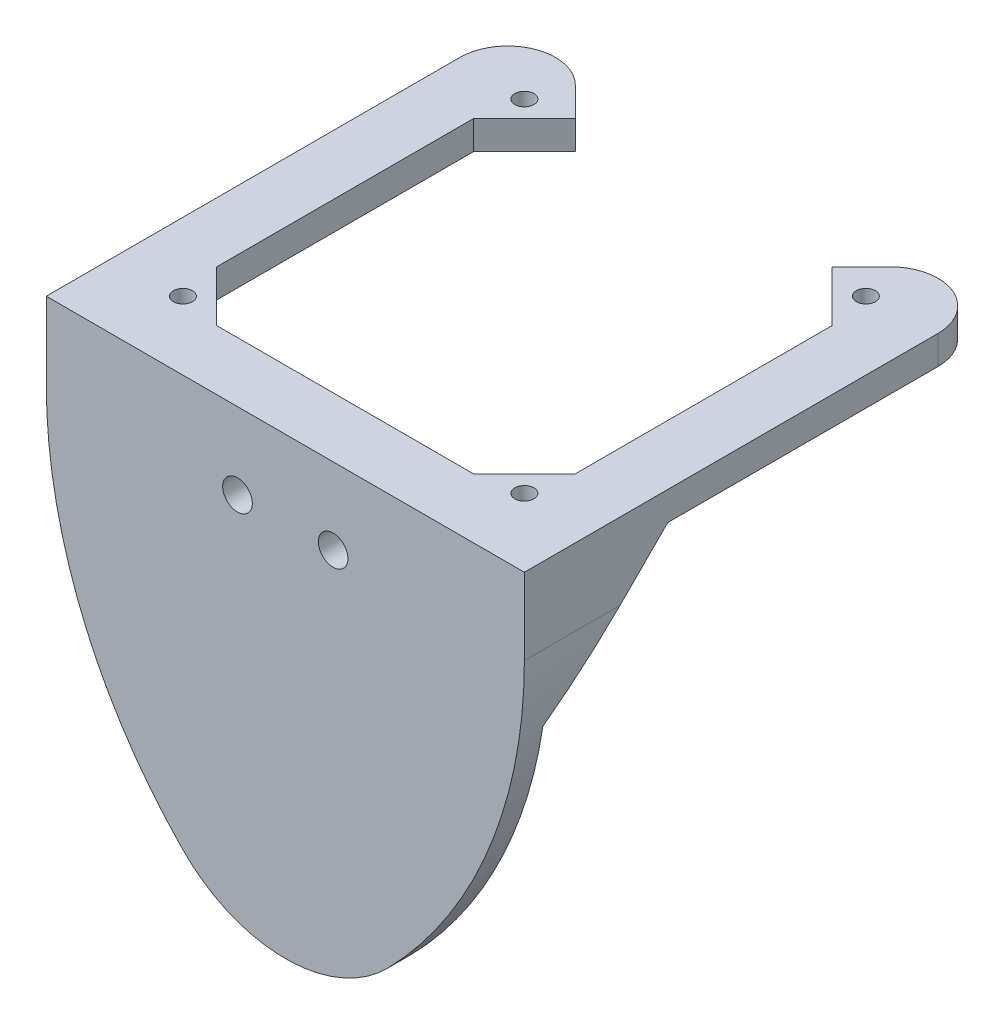
from build123d import *

# Parameters (mm, degrees)
SKETCH1_R           = 2
BOSS_EXTRUDE1_DEPTH = 6
CUT_EXTRUDE1_DEPTH  = 2.3
SKETCH3_R           = 3.1
BOSS_EXTRUDE2_DEPTH = 5
BOSS_EXTRUDE3_DEPTH = 5
FILLET1_R           = 7.5
BOSS_EXTRUDE4_DEPTH = 5
CUT_EXTRUDE2_REACH  = 139.089


with BuildPart() as part:
    # Sketch1 → Boss-Extrude1 (new body)
    with BuildSketch(Plane(origin=(0, 0, 0), x_dir=(1, 0, 0), z_dir=(0, 1, 0))):
        with BuildLine():
            Line((26.846717088, 0), (37.5, 10.653282912))
            Line((37.5, 10.653282912), (37.5, 64.346717088))
            Line((37.5, 64.346717088), (26.846717088, 75))
            Line((26.846717088, 75), (32.928932188, 81.0822151))
            ThreePointArc((32.928932188, 81.0822151), (43.826834324, 83.249942613), (50, 74.011147288))
            Line((50, 74.011147288), (50, -12.5))
            Line((50, -12.5), (-50, -12.5))
            Line((-50, -12.5), (-50, 74.011147288))
            ThreePointArc((-50, 74.011147288), (-43.826834324, 83.249942613), (-32.928932188, 81.0822151))
            Line((-32.928932188, 81.0822151), (-26.846717088, 75))
            Line((-26.846717088, 75), (-37.5, 64.346717088))
            Line((-37.5, 64.346717088), (-37.5, 10.653282912))
            Line((-37.5, 10.653282912), (-26.846717088, 0))
            Line((-26.846717088, 0), (26.846717088, 0))
        make_face()
        with Locations(Location((35.70889245, 1.79110755, 0), (0, 0, 270))):
            Circle(SKETCH1_R, mode=Mode.SUBTRACT)
        with Locations(Location((-35.70889245, 1.79110755, 0), (0, 0, 90))):
            Circle(SKETCH1_R, mode=Mode.SUBTRACT)
        with Locations(Location((35.70889245, 73.20889245, 0), (0, 0, 270))):
            Circle(SKETCH1_R, mode=Mode.SUBTRACT)
        with Locations(Location((-35.70889245, 73.20889245, 0), (0, 0, 90))):
            Circle(SKETCH1_R, mode=Mode.SUBTRACT)
    extrude(amount=BOSS_EXTRUDE1_DEPTH)

    # Sketch2 → Cut-Extrude1 (cut)
    with BuildSketch(Plane.XZ):
        Polygon((-37.325473204, -70.40889245), (-38.942053957, -73.20889245), (-37.325473204, -76.00889245), (-34.092311696, -76.00889245), (-32.475730942, -73.20889245), (-34.092311696, -70.40889245), align=None)
        Polygon((-38.942053957, -1.79110755), (-37.325473204, -4.59110755), (-34.092311696, -4.59110755), (-32.475730942, -1.79110755), (-34.092311696, 1.00889245), (-37.325473204, 1.00889245), align=None)
        Polygon((34.092311696, 1.00889245), (32.475730942, -1.79110755), (34.092311696, -4.59110755), (37.325473204, -4.59110755), (38.942053957, -1.79110755), (37.325473204, 1.00889245), align=None)
        Polygon((32.475730942, -73.20889245), (34.092311696, -76.00889245), (37.325473204, -76.00889245), (38.942053957, -73.20889245), (37.325473204, -70.40889245), (34.092311696, -70.40889245), align=None)
    extrude(amount=-CUT_EXTRUDE1_DEPTH, mode=Mode.SUBTRACT)

    # Sketch3 → Boss-Extrude2 (add)
    with BuildSketch(Plane.XY.offset(12.5)):
        with BuildLine():
            Line((-50, 0), (50, 0))
            Line((50, 0), (50, -10))
            ThreePointArc((50, -10), (42.582009977, -47.796447301), (21.428571429, -79.985421222))
            ThreePointArc((21.428571429, -79.985421222), (0, -88.989794856), (-21.428571429, -79.985421222))
            ThreePointArc((-21.428571429, -79.985421222), (-42.582009977, -47.796447301), (-50, -10))
            Line((-50, -10), (-50, 0))
        make_face()
        with Locations((10, -10)):
            Circle(SKETCH3_R, mode=Mode.SUBTRACT)
        with Locations((-10, -10)):
            Circle(SKETCH3_R, mode=Mode.SUBTRACT)
    extrude(amount=-BOSS_EXTRUDE2_DEPTH)

    # Sketch4 → Boss-Extrude3 (add)
    with BuildSketch(Plane(origin=(0, 0, 7.5), x_dir=(-1, 0, 0), z_dir=(0, 0, -1))):
        with BuildLine():
            Line((-20.888972746, -10), (-20.888972746, 0))
            Line((-20.888972746, 0), (0, 0))
            Line((0, 0), (20.888972746, 0))
            Line((20.888972746, 0), (20.888972746, -10))
            ThreePointArc((20.888972746, -10), (15.559129957, -19.36300174), (4.787214825, -19.560156807))
            ThreePointArc((4.787214825, -19.560156807), (0, -18.339825037), (-4.787214825, -19.560156807))
            ThreePointArc((-4.787214825, -19.560156807), (-15.559129957, -19.36300174), (-20.888972746, -10))
        make_face()
        Polygon((-10, -4.111027254), (-15.1, -7.055513627), (-15.1, -12.944486373), (-10, -15.888972746), (-4.9, -12.944486373), (-4.9, -7.055513627), align=None, mode=Mode.SUBTRACT)
        Polygon((4.9, -7.055513627), (10, -4.111027254), (15.1, -7.055513627), (15.1, -12.944486373), (10, -15.888972746), (4.9, -12.944486373), align=None, mode=Mode.SUBTRACT)
    extrude(amount=BOSS_EXTRUDE3_DEPTH)

    # Fillet1
    fillet1_edges = [part.edges().sort_by_distance(p)[0] for p in [
        (-20.888972746, 0, 5),
        (20.888972746, 0, 5),
    ]]
    fillet(fillet1_edges, radius=FILLET1_R)

    # Sketch5 → Boss-Extrude4 (add)
    with BuildSketch(Plane(origin=(50, 0, 0), x_dir=(0, 0, -1), z_dir=(1, 0, 0))):
        Polygon((17.5, 0), (-7.5, 0), (-7.5, -25), align=None)
    boss_extrude4 = extrude(amount=-BOSS_EXTRUDE4_DEPTH)

    # Mirror1: Boss-Extrude4 across plane
    add(boss_extrude4.mirror(Plane(origin=(0, 0, 0), x_dir=(0, 0, 1), z_dir=(1, 0, 0))))

    # Sketch6 → Cut-Extrude2 (cut, up to next)
    with BuildSketch(Plane.XY.offset(7.5), mode=Mode.PRIVATE) as cut_extrude2_sk1:
        with BuildLine():
            Line((50, -25), (50, -10))
            ThreePointArc((50, -10), (49.71674876, -17.521304187), (48.868599666, -25))
            Line((48.868599666, -25), (50, -25))
        make_face()
    cut_extrude2_tool1 = extrude(cut_extrude2_sk1.sketch, amount=-CUT_EXTRUDE2_REACH, mode=Mode.PRIVATE) & part.part
    # Sketch6 → Cut-Extrude2 (cut, up to next)
    with BuildSketch(Plane.XY.offset(7.5), mode=Mode.PRIVATE) as cut_extrude2_sk2:
        with BuildLine():
            Line((-50, -10), (-50, -25))
            Line((-50, -25), (-48.868599666, -25))
            ThreePointArc((-48.868599666, -25), (-49.71674876, -17.521304187), (-50, -10))
        make_face()
    cut_extrude2_tool2 = extrude(cut_extrude2_sk2.sketch, amount=-CUT_EXTRUDE2_REACH, mode=Mode.PRIVATE) & part.part
    add(cut_extrude2_tool1.solids().sort_by_distance((49.660912, -21.254256, 7.5))[0], mode=Mode.SUBTRACT)
    add(cut_extrude2_tool2.solids().sort_by_distance((-49.660912, -21.254256, 7.5))[0], mode=Mode.SUBTRACT)


solid = part.part
